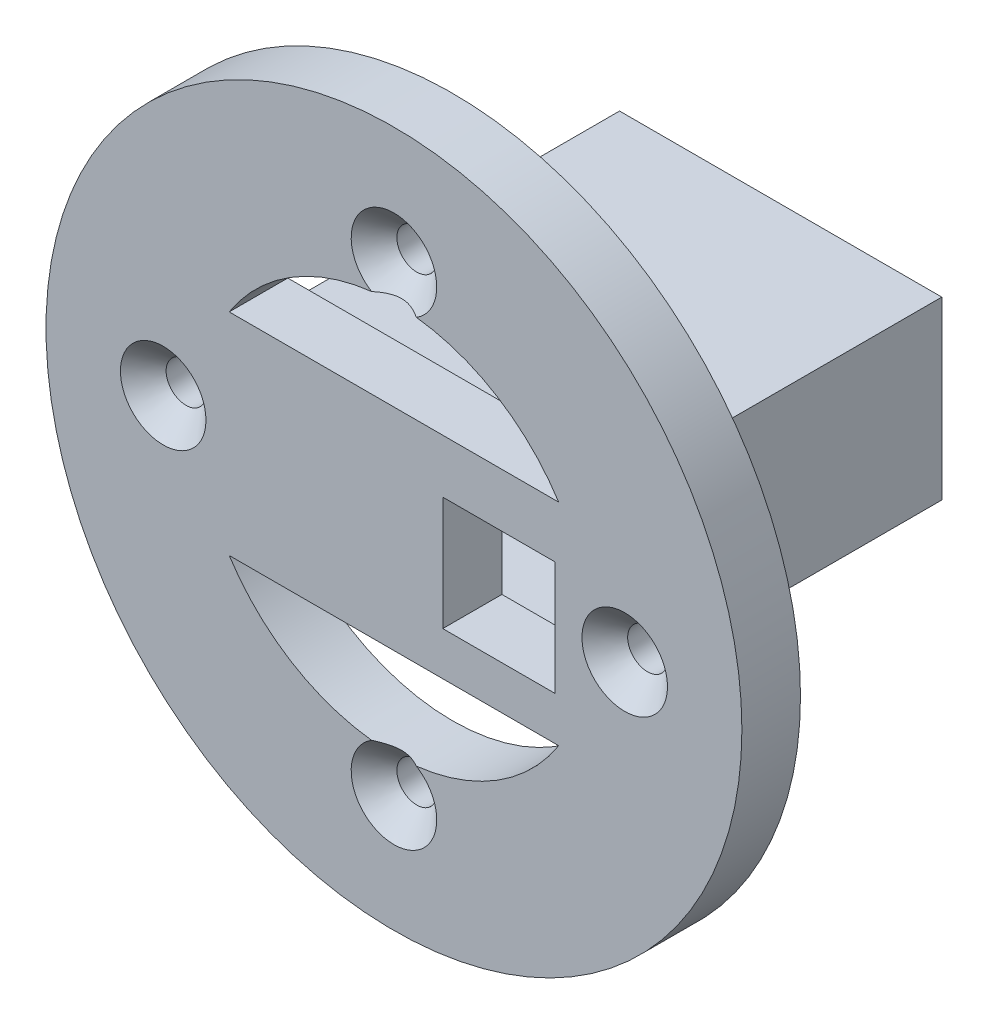
from build123d import *

# Parameters (mm, degrees)
SKETCH1_R                                       = 29.692527183
SKETCH1_R_2                                     = 22.692527183
SKETCH1_R_3                                     = 19.692527183
SKETCH1_R_4                                     = 16.692527183
BOSS_EXTRUDE1_DEPTH                             = 5
CSK_FOR_M3_FLAT_HEAD_MACHINE_SCREW2_D           = 3.4
CSK_FOR_M3_FLAT_HEAD_MACHINE_SCREW2_DEPTH       = 12
CSK_FOR_M3_FLAT_HEAD_MACHINE_SCREW2_CSINK_D     = 7.3
CSK_FOR_M3_FLAT_HEAD_MACHINE_SCREW2_CSINK_ANGLE = 90
CSK_FOR_M3_FLAT_HEAD_MACHINE_SCREW2_TIP         = 1.021463052
SKETCH9_W                                       = 27.5
SKETCH9_H                                       = 28
BOSS_EXTRUDE2_DEPTH                             = 7.5
SKETCH10_W                                      = 23.5
SKETCH10_H                                      = 25.45
CUT_EXTRUDE1_DEPTH                              = 6.1
SKETCH12_W                                      = 6
SKETCH12_H                                      = 11
CUT_EXTRUDE2_DEPTH                              = 3
CUT_EXTRUDE3_REACH                              = 55.407
SKETCH11_W                                      = 9.585282086
SKETCH11_H                                      = 9.717675131


with BuildPart() as part:
    # Sketch1 → Boss-Extrude1 (new body)
    # profile 1 of 4: a face of its own
    with BuildSketch(Plane(origin=(0, 0, 0), x_dir=(-1, 0, 0), z_dir=(0, 0, 1))):
        with Locations(Location((0, 0, 0), (0, 0, 180))):
            Circle(SKETCH1_R)
        Circle(SKETCH1_R_2, mode=Mode.SUBTRACT)
    # profile 2 of 4: a face of its own
    with BuildSketch(Plane(origin=(0, 0, 0), x_dir=(-1, 0, 0), z_dir=(0, 0, 1))):
        Circle(SKETCH1_R_2)
        Circle(SKETCH1_R_3, mode=Mode.SUBTRACT)
    # profile 3 of 4: a face of its own
    with BuildSketch(Plane(origin=(0, 0, 0), x_dir=(-1, 0, 0), z_dir=(0, 0, 1))):
        Circle(SKETCH1_R_3)
        Circle(SKETCH1_R_4, mode=Mode.SUBTRACT)
    # profile 4 of 4: a face of its own
    with BuildSketch(Plane(origin=(0, 0, 0), x_dir=(-1, 0, 0), z_dir=(0, 0, 1))):
        with BuildLine():
            Line((14.058465911, 9), (-14.058465911, 9))
            ThreePointArc((-14.058465911, 9), (-16.692527183, 0), (-14.058465911, -9))
            Line((-14.058465911, -9), (14.058465911, -9))
            ThreePointArc((14.058465911, -9), (16.020483578, -4.688770595), (16.692527183, 0))
            ThreePointArc((16.692527183, 0), (16.020483578, 4.688770595), (14.058465911, 9))
        make_face()
    extrude(amount=BOSS_EXTRUDE1_DEPTH)

    # CSK for M3 Flat Head Machine Screw2
    with Locations(Plane.XY.offset(5)):
        with Locations((0, 19.692527183), (0, -19.692527183), (19.692527183, 0), (-19.692527183, 0)):
            CounterSinkHole(CSK_FOR_M3_FLAT_HEAD_MACHINE_SCREW2_D / 2, CSK_FOR_M3_FLAT_HEAD_MACHINE_SCREW2_CSINK_D / 2, depth=CSK_FOR_M3_FLAT_HEAD_MACHINE_SCREW2_DEPTH, counter_sink_angle=CSK_FOR_M3_FLAT_HEAD_MACHINE_SCREW2_CSINK_ANGLE)
            with Locations((0, 0, -(CSK_FOR_M3_FLAT_HEAD_MACHINE_SCREW2_DEPTH + CSK_FOR_M3_FLAT_HEAD_MACHINE_SCREW2_TIP / 2))):  # 118° drill point
                Cone(0, CSK_FOR_M3_FLAT_HEAD_MACHINE_SCREW2_D / 2, CSK_FOR_M3_FLAT_HEAD_MACHINE_SCREW2_TIP, mode=Mode.SUBTRACT)

    # Sketch9 → Boss-Extrude2 (add, symmetric)
    with BuildSketch(Plane(origin=(0, 0, 0), x_dir=(1, 0, 0), z_dir=(0, 1, 0))):
        with Locations((0, 14)):
            Rectangle(SKETCH9_W, SKETCH9_H)
    extrude(amount=BOSS_EXTRUDE2_DEPTH, both=True)

    # Sketch10 → Cut-Extrude1 (cut, symmetric)
    with BuildSketch(Plane(origin=(0, 0, 0), x_dir=(1, 0, 0), z_dir=(0, 1, 0))):
        with Locations((0, 12.775)):
            Rectangle(SKETCH10_W, SKETCH10_H)
    extrude(amount=CUT_EXTRUDE1_DEPTH, both=True, mode=Mode.SUBTRACT)

    # Sketch12 → Cut-Extrude2 (cut)
    with BuildSketch(Plane.XY.offset(-28)):
        with Locations((8.75, 0)):
            Rectangle(SKETCH12_W, SKETCH12_H)
    extrude(amount=CUT_EXTRUDE2_DEPTH, mode=Mode.SUBTRACT)

    # Cut-Extrude3: up to this face of the body (flat: up to its plane)
    cut_extrude3_end = Plane(part.part.faces().sort_by_distance((0, 0, -0.05))[0])
    # Sketch11 → Cut-Extrude3 (cut, up to the picked face)
    with BuildSketch(Plane.XY.offset(5), mode=Mode.PRIVATE) as cut_extrude3_sk1:
        with Locations((8.957358957, -0.433824782)):
            Rectangle(SKETCH11_W, SKETCH11_H)
    cut_extrude3_tool1 = split(extrude(cut_extrude3_sk1.sketch, amount=-CUT_EXTRUDE3_REACH, mode=Mode.PRIVATE), bisect_by=cut_extrude3_end, keep=Keep.BOTH, mode=Mode.PRIVATE)
    add(cut_extrude3_tool1.solids().sort_by(Axis((8.957359, -0.433825, 5), (0, 0, -1)))[0], mode=Mode.SUBTRACT)


solid = part.part
